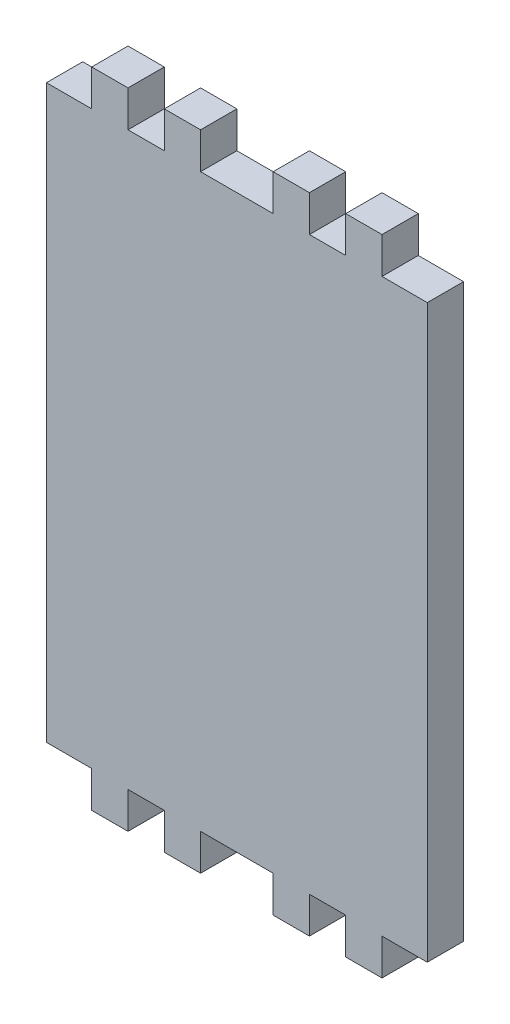
from build123d import *

# Parameters (mm, degrees)
SKETCH1_W           = 53.32
SKETCH1_H           = 79.98
BOSS_EXTRUDE1_DEPTH = 5.08
SKETCH2_W           = 5.08
SKETCH2_H           = 5.08
BOSS_EXTRUDE2_DEPTH = 5.08


with BuildPart() as part:
    # Sketch1 → Boss-Extrude1 (new body)
    with BuildSketch(Plane.XY):
        with Locations((19.705217391, 3.361478261)):
            Rectangle(SKETCH1_W, SKETCH1_H)
    extrude(amount=BOSS_EXTRUDE1_DEPTH)

    # Sketch2 → Boss-Extrude2 (add)
    with BuildSketch(Plane.XY.offset(5.08)):
        with Locations((1.925217391, 45.891478261)):
            Rectangle(SKETCH2_W, SKETCH2_H)
        with Locations((27.325217391, 45.891478261)):
            Rectangle(SKETCH2_W, SKETCH2_H)
        with Locations((37.485217391, 45.891478261)):
            Rectangle(SKETCH2_W, SKETCH2_H)
        with Locations((12.085217391, 45.891478261)):
            Rectangle(SKETCH2_W, SKETCH2_H)
        with Locations((12.085217391, -39.168521739)):
            Rectangle(SKETCH2_W, SKETCH2_H)
        with Locations((1.925217391, -39.168521739)):
            Rectangle(SKETCH2_W, SKETCH2_H)
        with Locations((37.485217391, -39.168521739)):
            Rectangle(SKETCH2_W, SKETCH2_H)
        with Locations((27.325217391, -39.168521739)):
            Rectangle(SKETCH2_W, SKETCH2_H)
    extrude(amount=-BOSS_EXTRUDE2_DEPTH)


solid = part.part
